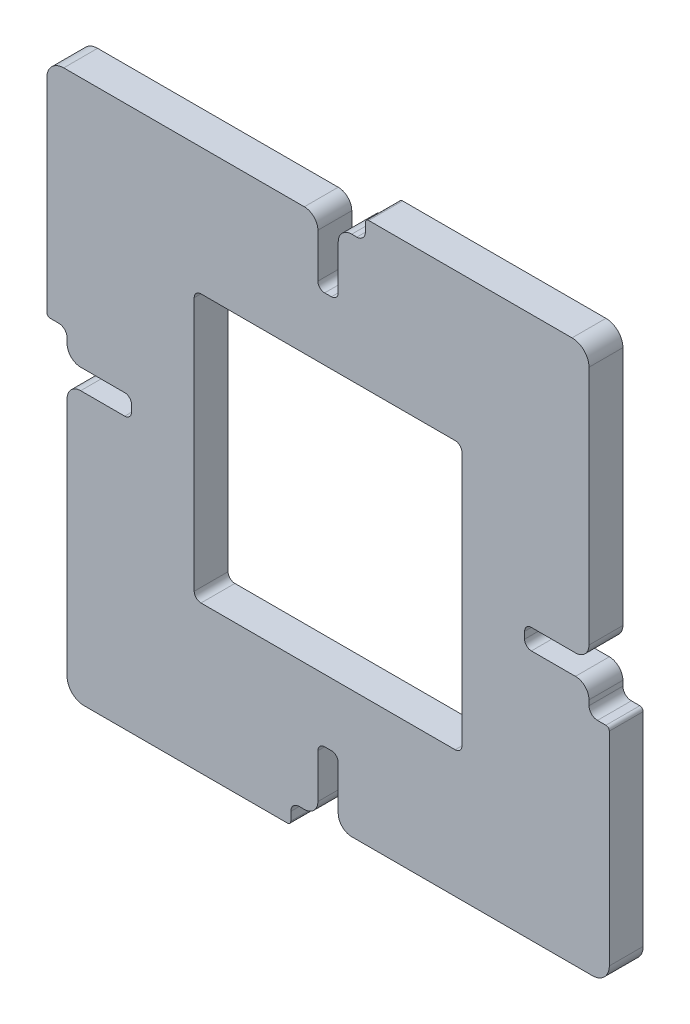
from build123d import *

# Parameters (mm, degrees)
EXTRUDE1_DEPTH    = 0.254
CIRPATTERN1_COUNT = 4


with BuildPart() as part:
    # Sketch2 → Extrude1 (new, symmetric)
    with BuildSketch(Plane.XY):
        with BuildLine():
            Line((-0.1524, 3.7084), (-0.1524, 3.048))
            ThreePointArc((-0.1524, 3.048), (-0.122642049, 2.976157951), (-0.0508, 2.9464))
            Line((-0.0508, 2.9464), (0.0508, 2.9464))
            ThreePointArc((0.0508, 2.9464), (0.122642049, 2.976157951), (0.1524, 3.048))
            Line((0.1524, 3.048), (0.1524, 3.7084))
            ThreePointArc((0.1524, 3.7084), (0.211915902, 3.852084098), (0.3556, 3.9116))
            Line((0.3556, 3.9116), (0.4318, 3.9116))
            ThreePointArc((0.4318, 3.9116), (0.521602561, 3.948797439), (0.5588, 4.0386))
            Line((0.5588, 4.0386), (0.5588, 4.1656))
            ThreePointArc((0.5588, 4.1656), (0.573678976, 4.201521024), (0.6096, 4.2164))
            Line((0.6096, 4.2164), (3.6576, 4.2164))
            ThreePointArc((3.6576, 4.2164), (3.837205122, 4.142005122), (3.9116, 3.9624))
            Line((3.9116, 3.9624), (3.9116, 0.762))
            Line((3.9116, 0.762), (2.0066, 0.762))
            Line((2.0066, 0.762), (2.0066, 1.905))
            ThreePointArc((2.0066, 1.905), (1.976842049, 1.976842049), (1.905, 2.0066))
            Line((1.905, 2.0066), (-0.889, 2.0066))
            Line((-0.889, 2.0066), (-0.889, 3.9116))
            Line((-0.889, 3.9116), (-0.3556, 3.9116))
            ThreePointArc((-0.3556, 3.9116), (-0.211915902, 3.852084098), (-0.1524, 3.7084))
        make_face()
    extrude1 = extrude(amount=EXTRUDE1_DEPTH, both=True)

    # CirPattern1: Extrude1 ×4 about axis
    cirpattern1_axis = Axis((0, 0, -69.733664692), (0, 0, 1))
    for i in range(1, CIRPATTERN1_COUNT):
        add(extrude1.rotate(cirpattern1_axis, i * 360 / CIRPATTERN1_COUNT))


solid = part.part
